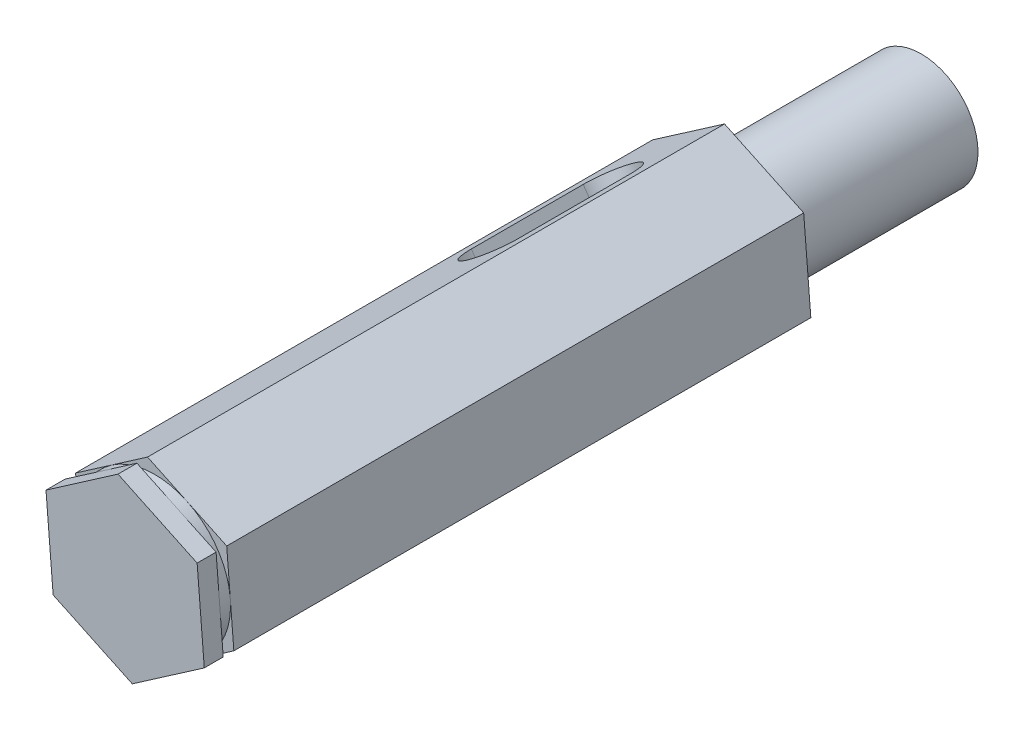
from build123d import *

# Parameters (mm, degrees)
SKETCH1_R           = 2.7305
BOSS_EXTRUDE1_DEPTH = 20.9042
BOSS_EXTRUDE2_DEPTH = 29.8958
BOSS_EXTRUDE3_START = 15.875
SKETCH3_R           = 4.75361
SKETCH3_R_2         = 2.7305
BOSS_EXTRUDE3_DEPTH = 15.875
CUT_EXTRUDE1_REACH  = 55.315
SKETCH5_R           = 7.62
SKETCH5_R_2         = 6.35
CUT_EXTRUDE4_DEPTH  = 0.889


with BuildPart() as part:
    # Sketch1 → Boss-Extrude1 (new body)
    with BuildSketch(Plane.XY):
        Polygon((6.029568492, 4.172246054), (-0.598486828, 7.307882515), (-6.62805532, 3.13563646), (-6.029568492, -4.172246054), (0.598486828, -7.307882515), (6.62805532, -3.13563646), align=None)
        Circle(SKETCH1_R, mode=Mode.SUBTRACT)
    extrude(amount=BOSS_EXTRUDE1_DEPTH)

    # Sketch2 → Boss-Extrude2 (add)
    with BuildSketch(Plane.XY.offset(20.9042)):
        Polygon((-6.62805532, 3.13563646), (-6.029568492, -4.172246054), (0.598486828, -7.307882515), (6.62805532, -3.13563646), (6.029568492, 4.172246054), (-0.598486828, 7.307882515), align=None)
    extrude(amount=BOSS_EXTRUDE2_DEPTH)

    # Sketch3 → Boss-Extrude3 (add)
    with BuildSketch(Plane(origin=(0, 0, 0), x_dir=(-1, 0, 0), z_dir=(0, 0, -1)).offset(BOSS_EXTRUDE3_START)):
        with Locations(Location((0, 0, 0), (0, 0, 180))):
            Circle(SKETCH3_R)
        Circle(SKETCH3_R_2, mode=Mode.SUBTRACT)
    extrude(amount=-BOSS_EXTRUDE3_DEPTH)

    # Cut-Extrude1: up to this face of the body (flat: up to its plane)
    cut_extrude1_end = Plane(part.part.faces().sort_by_distance((3.613271074, -5.221759488, 25.4))[0])
    # Sketch4 → Cut-Extrude1 (cut, up to the picked face)
    with BuildSketch(Plane(origin=(-3.613271074, 5.221759488, 0), x_dir=(0.8223243287496799, 0.5690190667687582, 0), z_dir=(-0.5690190667687582, 0.82232432874968, 0)), mode=Mode.PRIVATE) as cut_extrude1_sk1:
        with BuildLine():
            Line((-2.3876, -16.2306), (-2.3876, -6.858))
            ThreePointArc((-2.3876, -6.858), (0, -4.4704), (2.3876, -6.858))
            Line((2.3876, -6.858), (2.3876, -16.2306))
            ThreePointArc((2.3876, -16.2306), (0, -18.6182), (-2.3876, -16.2306))
        make_face()
    cut_extrude1_tool1 = split(extrude(cut_extrude1_sk1.sketch, amount=-CUT_EXTRUDE1_REACH, mode=Mode.PRIVATE), bisect_by=cut_extrude1_end, keep=Keep.BOTH, mode=Mode.PRIVATE)
    add(cut_extrude1_tool1.solids().sort_by(Axis((-3.613271, 5.221759, 11.5443), (0.5690190667687582, -0.82232432874968, 0)))[0], mode=Mode.SUBTRACT)

    # Sketch5 → Cut-Extrude4 (cut)
    with BuildSketch(Plane.XY.offset(49.2125)):
        Circle(SKETCH5_R)
        with Locations(Location((0, 0, 0), (0, 0, 4.681850588))):
            Circle(SKETCH5_R_2, mode=Mode.SUBTRACT)
    extrude(amount=-CUT_EXTRUDE4_DEPTH, mode=Mode.SUBTRACT)


solid = part.part
